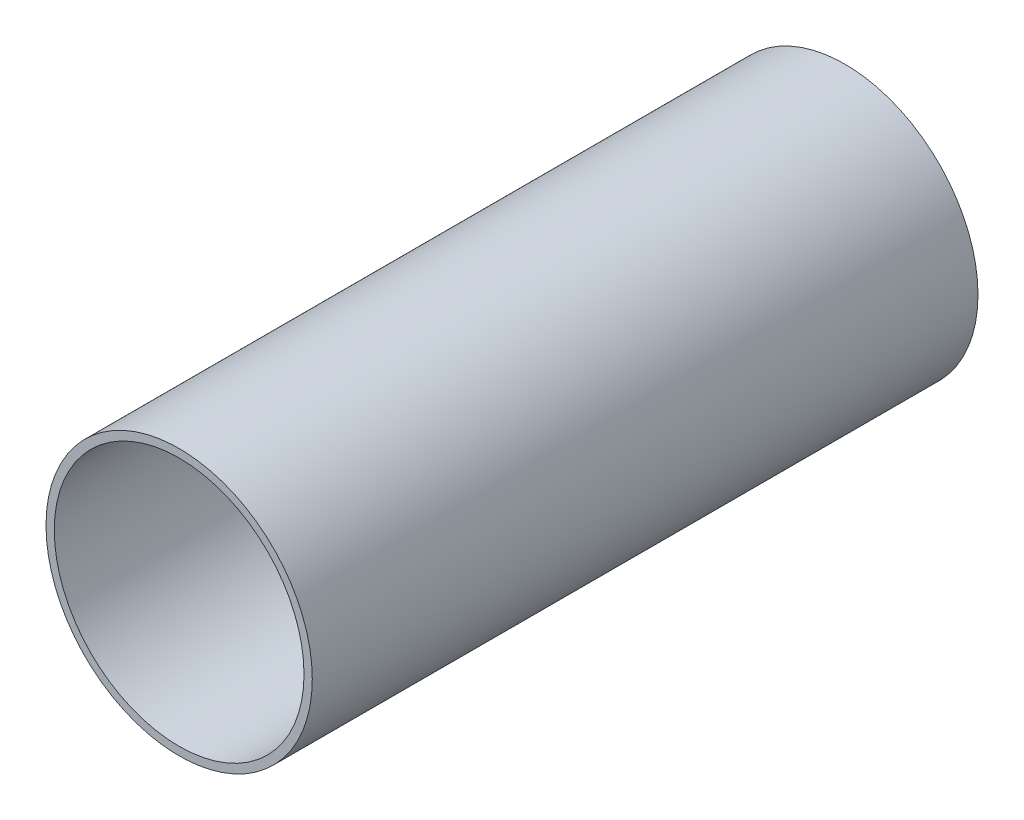
from build123d import *

# Parameters (mm, degrees)
SKETCH1_R           = 50.8
SKETCH1_R_2         = 47.645753054
BOSS_EXTRUDE1_DEPTH = 254


with BuildPart() as part:
    # Sketch1 → Boss-Extrude1 (new body)
    with BuildSketch(Plane.XY):
        Circle(SKETCH1_R)
        Circle(SKETCH1_R_2, mode=Mode.SUBTRACT)
    extrude(amount=BOSS_EXTRUDE1_DEPTH)


solid = part.part
